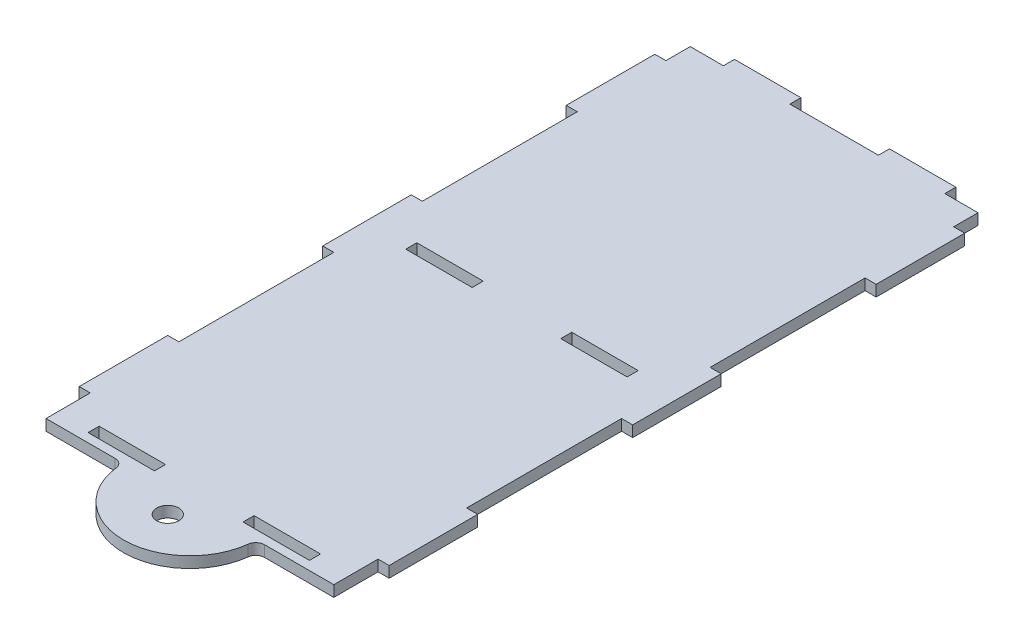
from build123d import *

# Parameters (mm, degrees)
SKETCH1_R           = 2.5
SKETCH1_W           = 15
SKETCH1_H           = 2.5
BOSS_EXTRUDE1_DEPTH = 2.5
FILLET1_R           = 2


with BuildPart() as part:
    # Sketch1 → Boss-Extrude1 (new body)
    with BuildSketch(Plane(origin=(0, 0, 0), x_dir=(1, 0, 0), z_dir=(0, 1, 0))):
        with BuildLine():
            Line((35, 45), (32.5, 45))
            Line((32.5, 45), (32.5, 10))
            Line((32.5, 10), (35, 10))
            Line((35, 10), (35, -10))
            Line((35, -10), (32.5, -10))
            Line((32.5, -10), (32.5, -45))
            Line((32.5, -45), (35, -45))
            Line((35, -45), (35, -65))
            Line((35, -65), (32.5, -65))
            Line((32.5, -65), (32.5, -75))
            Line((32.5, -75), (15, -75))
            ThreePointArc((15, -75), (0, -90), (-15, -75))
            Line((-15, -75), (-32.5, -75))
            Line((-32.5, -75), (-32.5, -65))
            Line((-32.5, -65), (-35, -65))
            Line((-35, -65), (-35, -45))
            Line((-35, -45), (-32.5, -45))
            Line((-32.5, -45), (-32.5, -10))
            Line((-32.5, -10), (-35, -10))
            Line((-35, -10), (-35, 10))
            Line((-35, 10), (-32.5, 10))
            Line((-32.5, 10), (-32.5, 45))
            Line((-32.5, 45), (-35, 45))
            Line((-35, 45), (-35, 65))
            Line((-35, 65), (-32.5, 65))
            Line((-32.5, 65), (-32.5, 70.5))
            Line((-32.5, 70.5), (-25, 70.5))
            Line((-25, 70.5), (-25, 73))
            Line((-25, 73), (-10, 73))
            Line((-10, 73), (-10, 70.5))
            Line((-10, 70.5), (10, 70.5))
            Line((10, 70.5), (10, 73))
            Line((10, 73), (25, 73))
            Line((25, 73), (25, 70.5))
            Line((25, 70.5), (32.5, 70.5))
            Line((32.5, 70.5), (32.5, 65))
            Line((32.5, 65), (35, 65))
            Line((35, 65), (35, 45))
        make_face()
        with Locations(Location((0, -80, 0), (0, 0, 270))):
            Circle(SKETCH1_R, mode=Mode.SUBTRACT)
        with Locations((17.5, 0)):
            Rectangle(SKETCH1_W, SKETCH1_H, mode=Mode.SUBTRACT)
        with Locations((-17.5, 0)):
            Rectangle(SKETCH1_W, SKETCH1_H, mode=Mode.SUBTRACT)
        with Locations((-17.5, -71.75)):
            Rectangle(SKETCH1_W, SKETCH1_H, mode=Mode.SUBTRACT)
        with Locations((17.5, -71.75)):
            Rectangle(SKETCH1_W, SKETCH1_H, mode=Mode.SUBTRACT)
    extrude(amount=BOSS_EXTRUDE1_DEPTH)

    # Fillet1
    fillet1_edges = [part.edges().sort_by_distance(p)[0] for p in [
        (15, 1.25, 75),
        (-15, 1.25, 75),
    ]]
    fillet(fillet1_edges, radius=FILLET1_R)


solid = part.part
